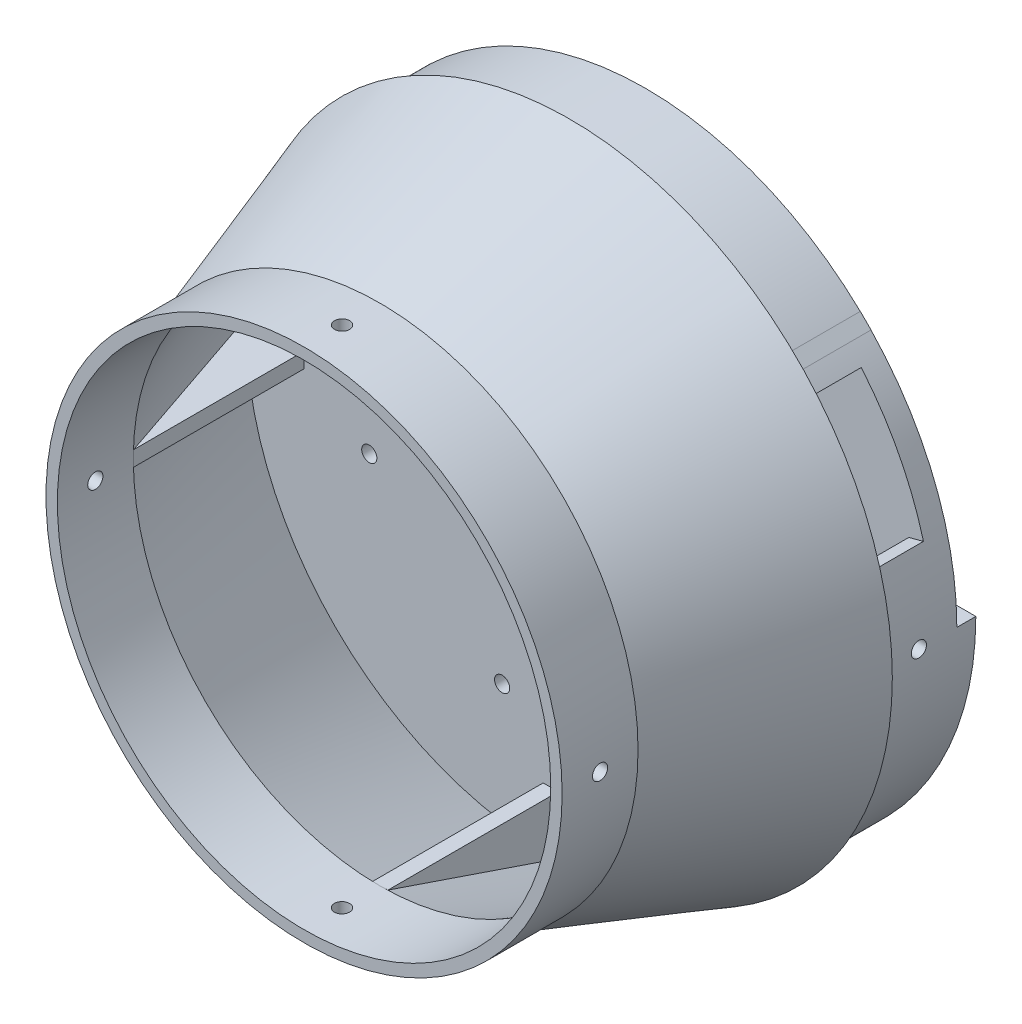
from build123d import *

# Parameters (mm, degrees)
BOSS_EXTRUDE5_DEPTH             = 2
CIRPATTERN3_COUNT               = 4
BOSS_EXTRUDE6_DEPTH             = 20
SKETCH14_R                      = 2
CUT_EXTRUDE1_DEPTH              = 95.00000000000004
CIRPATTERN4_COUNT               = 4
SKETCH16_R                      = 2.000000000000001
CUT_EXTRUDE2_DEPTH              = 94.00000000000004
CIRPATTERN5_COUNT               = 2
CIRPATTERN5_ANGLE               = 90.0000000000002
CIRPATTERN5_THE_OTHER_WAY_COUNT = 2
CIRPATTERN5_THE_OTHER_WAY_ANGLE = 90.0000000000002
SKETCH17_R                      = 2.0000000000000018
SKETCH17_R_2                    = 1.9999999999984424
SKETCH17_R_3                    = 1.9999999999962943
SKETCH17_R_4                    = 1.9999999999898757
CUT_EXTRUDE4_DEPTH              = 900
CUT_EXTRUDE7_START              = -20
CUT_EXTRUDE7_DEPTH              = 20
BOSS_EXTRUDE8_START             = -6
SKETCH22_R                      = 81.99999999999999
SKETCH22_R_2                    = 60
BOSS_EXTRUDE8_DEPTH             = 6
SKETCH24_R                      = 25
CUT_EXTRUDE8_DEPTH              = 5
SKETCH28_W                      = 13.999999999999986
SKETCH28_H                      = 19.999999999999986
BOSS_EXTRUDE9_DEPTH             = 2
CIRPATTERN6_COUNT               = 4
BOSS_EXTRUDE10_DEPTH            = 5
CUT_EXTRUDE11_DEPTH             = 10
CUT_EXTRUDE11_DEPTH_BACK        = 10
CUT_EXTRUDE12_START             = -10
CUT_EXTRUDE12_DEPTH             = 10
BOSS_EXTRUDE11_DEPTH            = 12
SKETCH32_R                      = 1.375000000000004
CUT_EXTRUDE13_DEPTH             = 10.000000000000002
SKETCH33_R                      = 1.3750000000000042
CUT_EXTRUDE14_DEPTH             = 10.000000000000002


with BuildPart() as part:
    # Sketch10 → Revolve2 (revolve)
    with BuildSketch(Plane(origin=(0, 0, 0), x_dir=(1, 0, 0), z_dir=(0, 1, 0))):
        Polygon((68, 0), (84.99999999999999, 50.000000000000014), (0, 50), (6.1e-16, 44.99999999999999), (80.29999999999998, 44.999999999999986), (65, -5.63e-15), (65, -20), (68, -20), align=None)
    revolve(axis=Axis((0, 0, 0), (0, 0, -1)))

    # Sketch12 → Boss-Extrude5 (add, symmetric)
    with BuildSketch(Plane(origin=(0, 0, 0), x_dir=(1, 0, 0), z_dir=(0, 1, 0))):
        Polygon((-80.29999999999998, 44.999999999999986), (-65, -6.94e-15), (-65, 44.999999999999986), align=None)
    boss_extrude5 = extrude(amount=BOSS_EXTRUDE5_DEPTH, both=True)

    # CirPattern3: Boss-Extrude5 ×4 about axis
    cirpattern3_axis = Axis((0, 0, -50.000000000000014), (0, 0, 1))
    for i in range(1, CIRPATTERN3_COUNT):
        add(boss_extrude5.rotate(cirpattern3_axis, i * 360 / CIRPATTERN3_COUNT))

    # Sketch13 → Boss-Extrude6 (add)
    with BuildSketch(Plane(origin=(0, 0, -50.00000000000001), x_dir=(-1, 0, 0), z_dir=(0, 0, -1))):
        with BuildLine():
            ThreePointArc((81.99999999999999, 0), (78.94301742396219, 22.181073012818818), (70, 42.70831300812521))
            ThreePointArc((70.00000000000001, 42.70831300812522), (-82, -3.73e-14), (70.00000000000003, -42.70831300812524))
            ThreePointArc((70, -42.70831300812522), (78.94301742396219, -22.18107301281883), (81.99999999999999, -2.008e-14))
        make_face()
        with BuildLine():
            ThreePointArc((70.00000000000001, -34.40930106817047), (-77.99999999999999, -3.02e-14), (70, 34.40930106817045))
            ThreePointArc((70.00000000000001, 34.40930106817046), (75.97367965289031, 17.663521732655667), (78, 0))
            ThreePointArc((78, -1.91e-14), (75.97367965289031, -17.663521732655717), (70.00000000000001, -34.40930106817047))
        make_face(mode=Mode.SUBTRACT)
    extrude(amount=BOSS_EXTRUDE6_DEPTH)

    # Sketch14 → Cut-Extrude1 (cut)
    with BuildSketch(Plane(origin=(0, 0, 0), x_dir=(1, 0, 0), z_dir=(0, 1, 0))):
        with Locations((0, -10)):
            Circle(SKETCH14_R)
    cut_extrude1 = extrude(amount=-CUT_EXTRUDE1_DEPTH, mode=Mode.SUBTRACT)

    # CirPattern4: Cut-Extrude1 ×4 about axis
    cirpattern4_axis = Axis((0, 0, 20), (0, 0, 1))
    for i in range(1, CIRPATTERN4_COUNT):
        add(cut_extrude1.rotate(cirpattern4_axis, i * 360 / CIRPATTERN4_COUNT), mode=Mode.SUBTRACT)

    # Sketch16 → Cut-Extrude2 (cut)
    with BuildSketch(Plane(origin=(0, 0, 0), x_dir=(1, 0, 0), z_dir=(0, 1, 0))):
        with Locations((0, 60.00000000000002)):
            Circle(SKETCH16_R)
    cut_extrude2 = extrude(amount=-CUT_EXTRUDE2_DEPTH, mode=Mode.SUBTRACT)

    # CirPattern5: Cut-Extrude2 ×2 about axis
    cirpattern5_axis = Axis((0, 0, -70), (0, 0, -1))
    for i in range(1, CIRPATTERN5_COUNT):
        add(cut_extrude2.rotate(cirpattern5_axis, i * CIRPATTERN5_ANGLE / (CIRPATTERN5_COUNT - 1)), mode=Mode.SUBTRACT)

    # CirPattern5 the other way: Cut-Extrude2 ×2 about axis
    cirpattern5_the_other_way_axis = Axis((0, 0, -70), (0, 0, 1))
    for i in range(1, CIRPATTERN5_THE_OTHER_WAY_COUNT):
        add(cut_extrude2.rotate(cirpattern5_the_other_way_axis, i * CIRPATTERN5_THE_OTHER_WAY_ANGLE / (CIRPATTERN5_THE_OTHER_WAY_COUNT - 1)), mode=Mode.SUBTRACT)

    # Sketch17 → Cut-Extrude4 (cut)
    with BuildSketch(Plane(origin=(0, 0, -50.00000000000001), x_dir=(-1, 0, 0), z_dir=(0, 0, -1))):
        with Locations((-47.81332840130892, 12.811542732574635)):
            Circle(SKETCH17_R)
        with Locations((-12.811542732574251, 47.813328401310926)):
            Circle(SKETCH17_R_2)
        with Locations((12.811542732575758, -47.81332840131803)):
            Circle(SKETCH17_R_3)
        with Locations((47.81332840131364, -12.811542732584947)):
            Circle(SKETCH17_R_4)
    extrude(amount=-CUT_EXTRUDE4_DEPTH, mode=Mode.SUBTRACT)

    # Sketch19 → Cut-Extrude7 (cut)
    with BuildSketch(Plane(origin=(0, 0, -70), x_dir=(-1, 0, 0), z_dir=(0, 0, -1)).offset(CUT_EXTRUDE7_START)):
        with BuildLine():
            Line((0, 0), (-79.20591775570364, 21.223161698406447))
            ThreePointArc((-79.20591775570364, 21.223161698406447), (-72.73488832061426, 37.86338628527262), (-62.81564433575629, 52.70858399429611))
            Line((-62.81564433575629, 52.70858399429611), (0, 0))
        make_face()
    cut_extrude7 = extrude(amount=CUT_EXTRUDE7_DEPTH, mode=Mode.SUBTRACT)

    # Mirror1: Cut-Extrude7 across plane
    add(cut_extrude7.mirror(Plane(origin=(0, 0, 0), x_dir=(0, 0, 1), z_dir=(1, 0, 0))), mode=Mode.SUBTRACT)

    # Sketch22 → Boss-Extrude8 (add)
    with BuildSketch(Plane(origin=(0, 0, -70), x_dir=(-1, 0, 0), z_dir=(0, 0, -1)).offset(BOSS_EXTRUDE8_START)):
        Circle(SKETCH22_R)
        Circle(SKETCH22_R_2, mode=Mode.SUBTRACT)
    extrude(amount=BOSS_EXTRUDE8_DEPTH)

    # Sketch24 → Cut-Extrude8 (cut)
    with BuildSketch(Plane(origin=(0, 0, -50.00000000000001), x_dir=(-1, 0, 0), z_dir=(0, 0, -1))):
        Circle(SKETCH24_R)
    extrude(amount=-CUT_EXTRUDE8_DEPTH, mode=Mode.SUBTRACT)

    # Sketch28 → Boss-Extrude9 (add, symmetric)
    with BuildSketch(Plane(origin=(0, 0, 0), x_dir=(0.7071067811865477, 0.7071067811865475, 0), z_dir=(-0.7071067811865475, 0.7071067811865477, 0))):
        with Locations((-75, 60.00000000000001)):
            Rectangle(SKETCH28_W, SKETCH28_H)
    boss_extrude9 = extrude(amount=BOSS_EXTRUDE9_DEPTH, both=True)

    # CirPattern6: Boss-Extrude9 ×4 about axis
    cirpattern6_axis = Axis((0, 0, -70), (0, 0, -1))
    for i in range(1, CIRPATTERN6_COUNT):
        add(boss_extrude9.rotate(cirpattern6_axis, i * 360 / CIRPATTERN6_COUNT))

    # Sketch29 → Boss-Extrude10 (add)
    with BuildSketch(Plane(origin=(0, 0, -70), x_dir=(-1, 0, 0), z_dir=(0, 0, -1))):
        with BuildLine():
            Line((-75.00000000000001, -5.2372e-13), (-81.99999999999999, -3.9762e-13))
            ThreePointArc((-81.99999999999999, -3.9762e-13), (2.0531e-13, -81.99999999999999), (81.99999999999999, 0))
            Line((81.99999999999999, 0), (75.00000000000001, 0))
            ThreePointArc((75.00000000000001, 0), (2.5439e-13, -75.00000000000001), (-75.00000000000001, -5.2372e-13))
        make_face()
    extrude(amount=BOSS_EXTRUDE10_DEPTH)

    # Sketch30 → Cut-Extrude11 (cut, two sides: drawn at the far end of the back side and taken through both)
    with BuildSketch(Plane(origin=(0, 0, -50.00000000000001), x_dir=(-1, 0, 0), z_dir=(0, 0, -1)).offset(-CUT_EXTRUDE11_DEPTH_BACK)):
        with BuildLine():
            ThreePointArc((-69.41422607543288, 9.036881007775852), (-64.09208645048781, 28.146126810330443), (-53.623111018328565, 44.99513267805769))
            Line((-53.623111018328565, 44.99513267805769), (-58.98542212016139, 49.49464594586343))
            ThreePointArc((-58.985422120161395, 49.49464594586345), (-70.50129509553655, 30.96073949136347), (-76.35564868297614, 9.94056910855342))
            Line((-76.35564868297612, 9.940569108553424), (-69.41422607543286, 9.036881007775847))
        make_face()
    extrude(amount=CUT_EXTRUDE11_DEPTH + CUT_EXTRUDE11_DEPTH_BACK, mode=Mode.SUBTRACT)

    # Sketch30<5> → Cut-Extrude12 (cut)
    with BuildSketch(Plane(origin=(0, 0, -50.00000000000001), x_dir=(-1, 0, 0), z_dir=(0, 0, -1)).offset(CUT_EXTRUDE12_START)):
        with BuildLine():
            ThreePointArc((76.70699175306436, 6.7109921915700195), (71.13872400336902, 29.466624292112016), (58.98542212016139, 49.49464594586343))
            Line((58.98542212016139, 49.49464594586343), (53.62311101832856, 44.995132678057686))
            ThreePointArc((53.62311101832856, 44.995132678057686), (64.67156727579004, 26.787840265556376), (69.7336288664222, 6.100901992336384))
            Line((69.7336288664222, 6.100901992336384), (76.70699175306437, 6.7109921915700195))
        make_face()
    extrude(amount=CUT_EXTRUDE12_DEPTH, mode=Mode.SUBTRACT)

    # Sketch31 → Boss-Extrude11 (add)
    with BuildSketch(Plane(origin=(0, 0, -50.00000000000001), x_dir=(-1, 0, 0), z_dir=(0, 0, -1))):
        Polygon((-39.12930535268962, 8.825953921020487), (-38.25219023852143, 11.694868188909497), (-49.727847310077834, 15.203328645582438), (-47.68124537701867, 21.89746193732369), (-52.46276915683384, 23.35932046093738), (-55.38648620406122, 13.796272901307026), align=None)
        Polygon((-41.97016119651599, -14.147281333827634), (-62.05256107173972, -8.007475534650153), (-64.97627811896716, -17.570523094280485), (-60.19475433915192, -19.032381617894185), (-58.14815240609272, -12.338248326152952), (-42.8472763106842, -17.01619560171674), align=None)
    boss_extrude11 = extrude(amount=BOSS_EXTRUDE11_DEPTH)

    # Sketch32 → Cut-Extrude13 (cut)
    with BuildSketch(Plane(origin=(54.50937108989304, 16.665187169196024, 0), x_dir=(0, 0, -1), z_dir=(0.9563047559630353, 0.2923717047227371, 0))):
        with Locations((56.20000000000001, -0.3999999999998883)):
            Circle(SKETCH32_R)
    cut_extrude13 = extrude(amount=-CUT_EXTRUDE13_DEPTH, mode=Mode.SUBTRACT)

    # Sketch33 → Cut-Extrude14 (cut)
    with BuildSketch(Plane(origin=(54.5093710898929, 16.665187169196354, 0), x_dir=(0, 0, -1), z_dir=(0.9563047559630337, 0.2923717047227432, 0))):
        with Locations((56.20000000000002, -28.400000000000244)):
            Circle(SKETCH33_R)
    cut_extrude14 = extrude(amount=-CUT_EXTRUDE14_DEPTH, mode=Mode.SUBTRACT)

    # Mirror2: Boss-Extrude11, Cut-Extrude13, Cut-Extrude14 across plane
    add(boss_extrude11.mirror(Plane(origin=(0, 0, 0), x_dir=(0, 0, 1), z_dir=(1, 0, 0))))
    add(cut_extrude13.mirror(Plane(origin=(0, 0, 0), x_dir=(0, 0, 1), z_dir=(1, 0, 0))), mode=Mode.SUBTRACT)
    add(cut_extrude14.mirror(Plane(origin=(0, 0, 0), x_dir=(0, 0, 1), z_dir=(1, 0, 0))), mode=Mode.SUBTRACT)


solid = part.part
